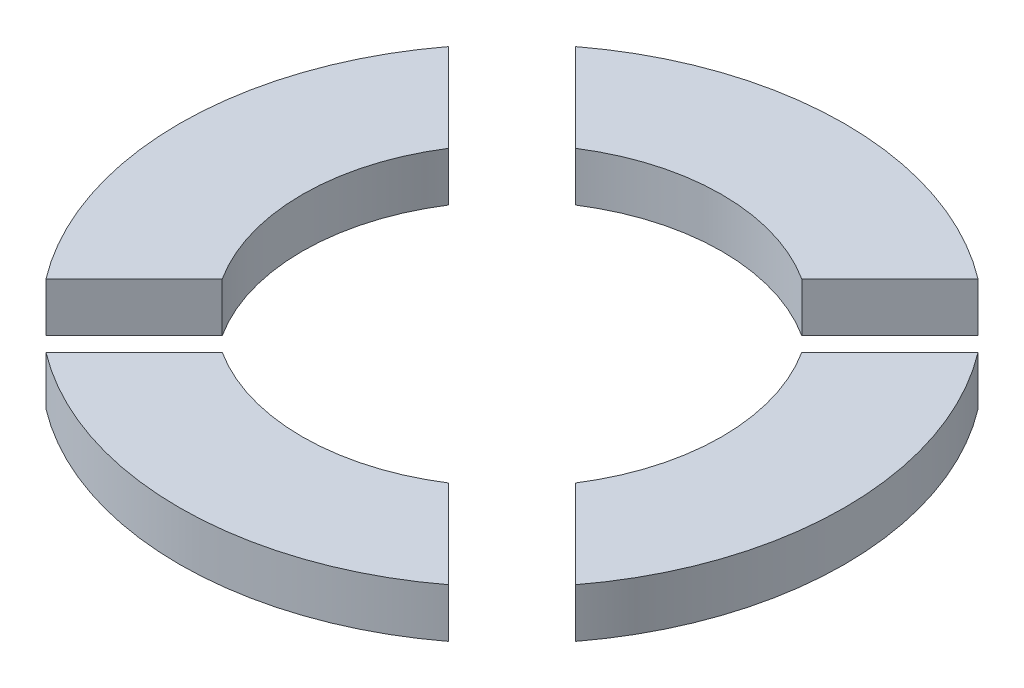
from build123d import *

# Parameters (mm, degrees)
BOSS_EXTRUDE1_DEPTH   = 0.12
BOSS_EXTRUDE1_2_DEPTH = 0.12
BOSS_EXTRUDE1_3_DEPTH = 0.12
BOSS_EXTRUDE1_4_DEPTH = 0.12


with BuildPart() as part:
    # Sketch1 → Boss-Extrude1 (new body)
    with BuildSketch(Plane(origin=(0, 0, 0), x_dir=(1, 0, 0), z_dir=(0, 1, 0))):
        with BuildLine():
            Line((-0.491452938, -0.64701643), (-0.276164754, -0.431728246))
            ThreePointArc((-0.276164754, -0.431728246), (0, -0.5125), (0.276164754, -0.431728246))
            Line((0.276164754, -0.431728246), (0.491452938, -0.64701643))
            ThreePointArc((0.491452938, -0.64701643), (0, -0.8125), (-0.491452938, -0.64701643))
        make_face()
    extrude(amount=BOSS_EXTRUDE1_DEPTH)


with BuildPart() as body_2:
    # Sketch1 → Boss-Extrude1 2 (new body)
    with BuildSketch(Plane(origin=(0, 0, 0), x_dir=(1, 0, 0), z_dir=(0, 1, 0))):
        with BuildLine():
            Line((0.491452938, 0.64701643), (0.276164754, 0.431728246))
            ThreePointArc((0.276164754, 0.431728246), (0, 0.5125), (-0.276164754, 0.431728246))
            Line((-0.276164754, 0.431728246), (-0.491452938, 0.64701643))
            ThreePointArc((-0.491452938, 0.64701643), (0, 0.8125), (0.491452938, 0.64701643))
        make_face()
    extrude(amount=BOSS_EXTRUDE1_2_DEPTH)


with BuildPart() as body_3:
    # Sketch1 → Boss-Extrude1 3 (new body)
    with BuildSketch(Plane(origin=(0, 0, 0), x_dir=(1, 0, 0), z_dir=(0, 1, 0))):
        with BuildLine():
            Line((-0.64701643, 0.491452938), (-0.431728246, 0.276164754))
            ThreePointArc((-0.431728246, 0.276164754), (-0.5125, 0), (-0.431728246, -0.276164754))
            Line((-0.431728246, -0.276164754), (-0.64701643, -0.491452938))
            ThreePointArc((-0.64701643, -0.491452938), (-0.8125, 0), (-0.64701643, 0.491452938))
        make_face()
    extrude(amount=BOSS_EXTRUDE1_3_DEPTH)


with BuildPart() as body_4:
    # Sketch1 → Boss-Extrude1 4 (new body)
    with BuildSketch(Plane(origin=(0, 0, 0), x_dir=(1, 0, 0), z_dir=(0, 1, 0))):
        with BuildLine():
            Line((0.431728246, 0.276164754), (0.64701643, 0.491452938))
            ThreePointArc((0.64701643, 0.491452938), (0.8125, 0), (0.64701643, -0.491452938))
            Line((0.64701643, -0.491452938), (0.431728246, -0.276164754))
            ThreePointArc((0.431728246, -0.276164754), (0.5125, 0), (0.431728246, 0.276164754))
        make_face()
    extrude(amount=BOSS_EXTRUDE1_4_DEPTH)


solid = Compound([part.part, body_2.part, body_3.part, body_4.part])
